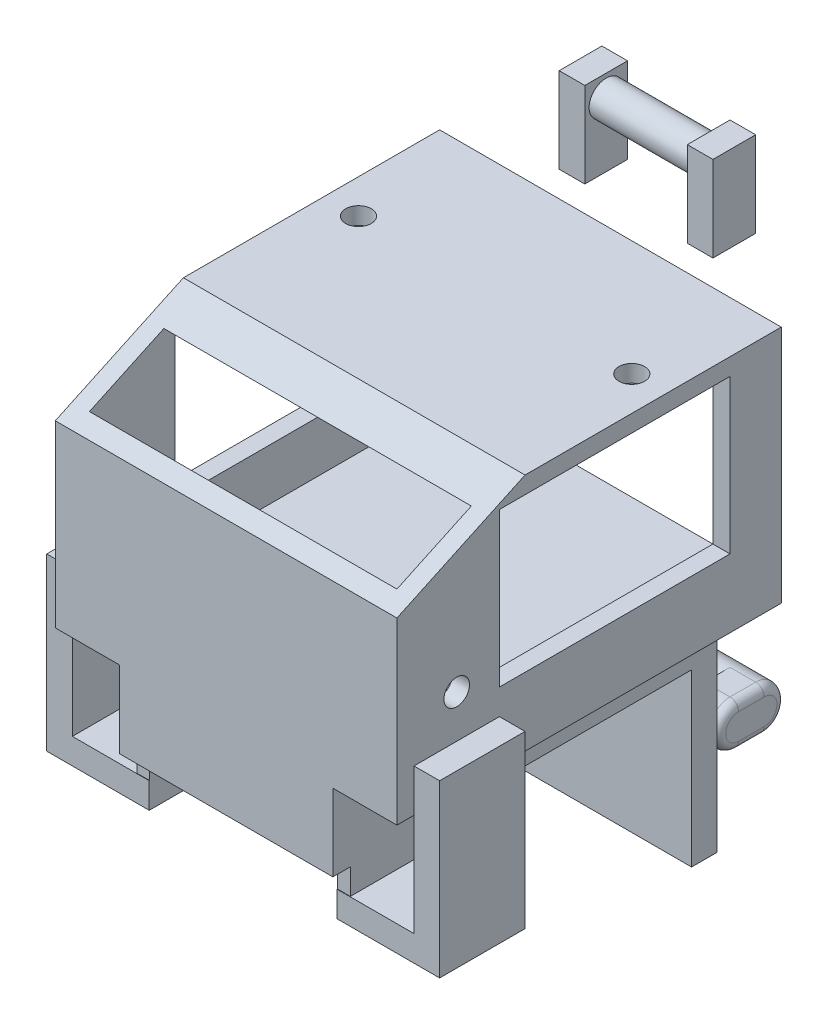
from build123d import *

# Parameters (mm, degrees)
SKETCH_1_W               = 25
SKETCH_1_H               = 42
EXTRUDE_1_DEPTH          = 9
SKETCH_2_W               = 25
SKETCH_2_H               = 29
EXTRUDE_2_DEPTH          = 3
SKETCH_3_W               = 40
SKETCH_3_H               = 45
EXTRUDE_3_DEPTH          = 28
SKETCH_4_W               = 36
SKETCH_4_H               = 24
CUT_EXTRUDE_1_DEPTH      = 43
SKETCH_6_W               = 10
SKETCH_6_H               = 20
EXTRUDE_4_DEPTH          = 3
SKETCH_7_W               = 9
SKETCH_7_H               = 10
EXTRUDE_5_DEPTH          = 3
SKETCH_8_W               = 3
SKETCH_8_H               = 5
EXTRUDE_6_DEPTH          = 10
EXTRUDE_6_2_DEPTH        = 10
SKETCH_9_R               = 2
EXTRUDE_7_DEPTH          = 12
SKETCH_10_R              = 1.5
CUT_EXTRUDE_2_DEPTH      = 83.867363902
SKETCH_11_R              = 2.5
EXTRUDE_8_DEPTH          = 9
SKETCH_12_R              = 2.5
EXTRUDE_9_DEPTH          = 7
EXTRUDE_10_DEPTH         = 4
FILLET_1_R               = 1
FILLET_1_OF_MIRROR_2_R   = 1
CUT_EXTRUDE_3_DEPTH      = 84.834658704
CUT_EXTRUDE_5_DEPTH      = 83.826626154
CUT_EXTRUDE_5_DEPTH_BACK = 83.826626154
SKETCH_19_W              = 27
SKETCH_19_H              = 18
CUT_EXTRUDE_6_DEPTH      = 87.484102585
CUT_EXTRUDE_6_DEPTH_BACK = 10
SKETCH_20_R              = 1.5
SKETCH_21_W              = 3
SKETCH_21_H              = 5
EXTRUDE_11_DEPTH         = 10
EXTRUDE_12_REACH         = 79.97
SKETCH_22_R              = 2.5
SKETCH_23_W              = 9.954208599
SKETCH_23_H              = 3
EXTRUDE_13_DEPTH         = 1.5


with BuildPart() as part:
    # ｽｹｯﾁ1 → ﾎﾞｽ - 押し出し1 (new body)
    with BuildSketch(Plane(origin=(0, 0, 0), x_dir=(1, 0, 0), z_dir=(0, 1, 0))):
        with Locations((12.5, 21)):
            Rectangle(SKETCH_1_W, SKETCH_1_H)
    extrude(amount=EXTRUDE_1_DEPTH)

    # ｽｹｯﾁ2 → ﾎﾞｽ - 押し出し2 (add)
    with BuildSketch(Plane(origin=(0, 0, -42), x_dir=(-1, 0, 0), z_dir=(0, 0, -1))):
        with Locations((-12.5, -5.5)):
            Rectangle(SKETCH_2_W, SKETCH_2_H)
    extrude(amount=EXTRUDE_2_DEPTH)

    # ｽｹｯﾁ3 → ﾎﾞｽ - 押し出し3 (add)
    with BuildSketch(Plane(origin=(0, 9, 0), x_dir=(1, 0, 0), z_dir=(0, 1, 0))):
        with Locations((12.5, 22.5)):
            Rectangle(SKETCH_3_W, SKETCH_3_H)
    extrude(amount=EXTRUDE_3_DEPTH)

    # ｽｹｯﾁ4 → ｶｯﾄ - 押し出し1 (cut)
    with BuildSketch(Plane(origin=(0, 0, -45), x_dir=(-1, 0, 0), z_dir=(0, 0, -1))):
        with Locations((-12.5, 23)):
            Rectangle(SKETCH_4_W, SKETCH_4_H)
    extrude(amount=-CUT_EXTRUDE_1_DEPTH, mode=Mode.SUBTRACT)

    # ｽｹｯﾁ6 → ﾎﾞｽ - 押し出し4 (add)
    with BuildSketch(Plane(origin=(32.5, 0, 0), x_dir=(0, 0, -1), z_dir=(1, 0, 0))):
        with Locations((7, 4)):
            Rectangle(SKETCH_6_W, SKETCH_6_H)
    extrude_4 = extrude(amount=EXTRUDE_4_DEPTH)

    # ｽｹｯﾁ7 → ﾎﾞｽ - 押し出し5 (add)
    with BuildSketch(Plane.XZ.offset(6)):
        with Locations((28, -7)):
            Rectangle(SKETCH_7_W, SKETCH_7_H)
    extrude_5 = extrude(amount=-EXTRUDE_5_DEPTH)

    # ﾐﾗｰ1: ﾎﾞｽ - 押し出し4, ﾎﾞｽ - 押し出し5 across plane
    add(extrude_4.mirror(Plane(origin=(12.5, 0, 0), x_dir=(0, 0, 1), z_dir=(1, 0, 0))))
    add(extrude_5.mirror(Plane(origin=(12.5, 0, 0), x_dir=(0, 0, 1), z_dir=(1, 0, 0))))

    # ｽｹｯﾁ10 → ｶｯﾄ - 押し出し2 (cut, through all)
    with BuildSketch(Plane.ZY.offset(7.5)):
        with Locations((-7, 19)):
            Circle(SKETCH_10_R)
    extrude(amount=-CUT_EXTRUDE_2_DEPTH, mode=Mode.SUBTRACT)

    # ｽｹｯﾁ11 → ﾎﾞｽ - 押し出し8 (add)
    with BuildSketch(Plane(origin=(0, 0, -45), x_dir=(-1, 0, 0), z_dir=(0, 0, -1))):
        with Locations((-12.5, -10)):
            Circle(SKETCH_11_R)
    extrude(amount=EXTRUDE_8_DEPTH)

    # ｽｹｯﾁ12 → ﾎﾞｽ - 押し出し9 (add)
    with BuildSketch(Plane(origin=(12.5, 0, 0), x_dir=(0, 0, -1), z_dir=(1, 0, 0))):
        with Locations(Location((52, -10, 0), (0, 0, 143.130102354))):
            Circle(SKETCH_12_R)
    extrude_9 = extrude(amount=EXTRUDE_9_DEPTH)

    # ｽｹｯﾁ13 → ﾎﾞｽ - 押し出し10 (add)
    with BuildSketch(Plane(origin=(19.5, 0, 0), x_dir=(0, 0, -1), z_dir=(1, 0, 0))):
        with BuildLine():
            Line((52, -12.5), (49, -12.5))
            ThreePointArc((49, -12.5), (46.5, -10), (49, -7.5))
            Line((49, -7.5), (52, -7.5))
            ThreePointArc((52, -7.5), (54.5, -10), (52, -12.5))
        make_face()
    extrude_10 = extrude(amount=EXTRUDE_10_DEPTH)

    # ﾌｨﾚｯﾄ1
    fillet_1_edges = [part.edges().sort_by_distance(p)[0] for p in [
        (23.5, -10, -54.5),
        (23.5, -7.5, -50.5),
        (23.5, -10, -46.5),
        (23.5, -12.5, -50.5),
    ]]
    fillet(fillet_1_edges, radius=FILLET_1_R)

    # ﾐﾗｰ2: ﾎﾞｽ - 押し出し9, ﾎﾞｽ - 押し出し10 across plane
    add(extrude_9.mirror(Plane(origin=(12.5, 0, 0), x_dir=(0, 0, 1), z_dir=(1, 0, 0))))
    add(extrude_10.mirror(Plane(origin=(12.5, 0, 0), x_dir=(0, 0, 1), z_dir=(1, 0, 0))))

    # ﾌｨﾚｯﾄ1 of ﾐﾗｰ2
    fillet_1_of_mirror_2_edges = [part.edges().sort_by_distance(p)[0] for p in [
        (1.5, -10, -54.5),
        (1.5, -7.5, -50.5),
        (1.5, -10, -46.5),
        (1.5, -12.5, -50.5),
    ]]
    fillet(fillet_1_of_mirror_2_edges, radius=FILLET_1_OF_MIRROR_2_R)

    # ｽｹｯﾁ14 → ｶｯﾄ - 押し出し3 (cut, through all)
    with BuildSketch(Plane.ZY.offset(7.5)):
        Polygon((-15, 37), (0, 30), (0, 37), align=None)
    extrude(amount=-CUT_EXTRUDE_3_DEPTH, mode=Mode.SUBTRACT)

    # ｽｹｯﾁ19 → ｶｯﾄ - 押し出し5 (cut, two sides: drawn at the far end of the back side and taken through both)
    with BuildSketch(Plane.ZY.offset(-30.5).offset(-CUT_EXTRUDE_5_DEPTH_BACK)):
        with Locations((-25.5, 26)):
            Rectangle(SKETCH_19_W, SKETCH_19_H)
    extrude(amount=CUT_EXTRUDE_5_DEPTH + CUT_EXTRUDE_5_DEPTH_BACK, mode=Mode.SUBTRACT)

    # ｽｹｯﾁ20 → ｶｯﾄ - 押し出し6 (cut, two sides: drawn at the far end of the back side and taken through both)
    with BuildSketch(Plane(origin=(0, 37, 0), x_dir=(1, 0, 0), z_dir=(0, 1, 0)).offset(-CUT_EXTRUDE_6_DEPTH_BACK)):
        with Locations(Location((-3.5, 31.5, 0), (0, 0, 90))):
            Circle(SKETCH_20_R)
        with Locations(Location((28.5, 31.5, 0), (0, 0, 90))):
            Circle(SKETCH_20_R)
    extrude(amount=CUT_EXTRUDE_6_DEPTH + CUT_EXTRUDE_6_DEPTH_BACK, mode=Mode.SUBTRACT)

    # ｽｹｯﾁ21 → ﾎﾞｽ - 押し出し11 (add)
    with BuildSketch(Plane.XZ.offset(-35)):
        with Locations((21, -42.5)):
            Rectangle(SKETCH_21_W, SKETCH_21_H)
        with Locations((4, -42.5)):
            Rectangle(SKETCH_21_W, SKETCH_21_H)
    extrude(amount=EXTRUDE_11_DEPTH)

    # ｽｹｯﾁ22 → ﾎﾞｽ - 押し出し12 (add, up to next)
    with BuildSketch(Plane.ZY.offset(-19.5), mode=Mode.PRIVATE) as extrude_12_sk1:
        with Locations((-42.5, 27.5)):
            Circle(SKETCH_22_R)
    extrude_12_tool1 = extrude(extrude_12_sk1.sketch, amount=EXTRUDE_12_REACH, mode=Mode.PRIVATE) - part.part
    add(extrude_12_tool1.solids().sort_by_distance((19.5, 27.5, -42.5))[0])

    # ｽｹｯﾁ23 → ﾎﾞｽ - 押し出し13 (add)
    with BuildSketch(Plane(origin=(1.5, 0, 0), x_dir=(0, 0, -1), z_dir=(1, 0, 0))):
        with Locations((7.022895701, -1.5)):
            Rectangle(SKETCH_23_W, SKETCH_23_H)
    extrude_13 = extrude(amount=-EXTRUDE_13_DEPTH)

    # ﾐﾗｰ3: ﾎﾞｽ - 押し出し13 across plane
    add(extrude_13.mirror(Plane(origin=(12.5, 0, 0), x_dir=(0, 0, 1), z_dir=(1, 0, 0))))


with BuildPart() as body_2:
    # ｽｹｯﾁ8 → ﾎﾞｽ - 押し出し6 (new body)
    with BuildSketch(Plane(origin=(0, 37, 0), x_dir=(1, 0, 0), z_dir=(0, 1, 0))):
        with Locations((5, 50.5)):
            Rectangle(SKETCH_8_W, SKETCH_8_H)
    extrude(amount=EXTRUDE_6_DEPTH)


with BuildPart() as body_3:
    # ｽｹｯﾁ8 → Extrude 6 2 (new body)
    with BuildSketch(Plane(origin=(0, 37, 0), x_dir=(1, 0, 0), z_dir=(0, 1, 0))):
        with Locations((20, 50.5)):
            Rectangle(SKETCH_8_W, SKETCH_8_H)
    extrude(amount=EXTRUDE_6_2_DEPTH)


with BuildPart() as body_4:
    # ｽｹｯﾁ9 → ﾎﾞｽ - 押し出し7 (new body)
    with BuildSketch(Plane(origin=(6.5, 0, 0), x_dir=(0, 0, -1), z_dir=(1, 0, 0))):
        with Locations((50.5, 44.5)):
            Circle(SKETCH_9_R)
    extrude(amount=EXTRUDE_7_DEPTH)


solid = Compound([part.part, body_2.part, body_3.part, body_4.part])
